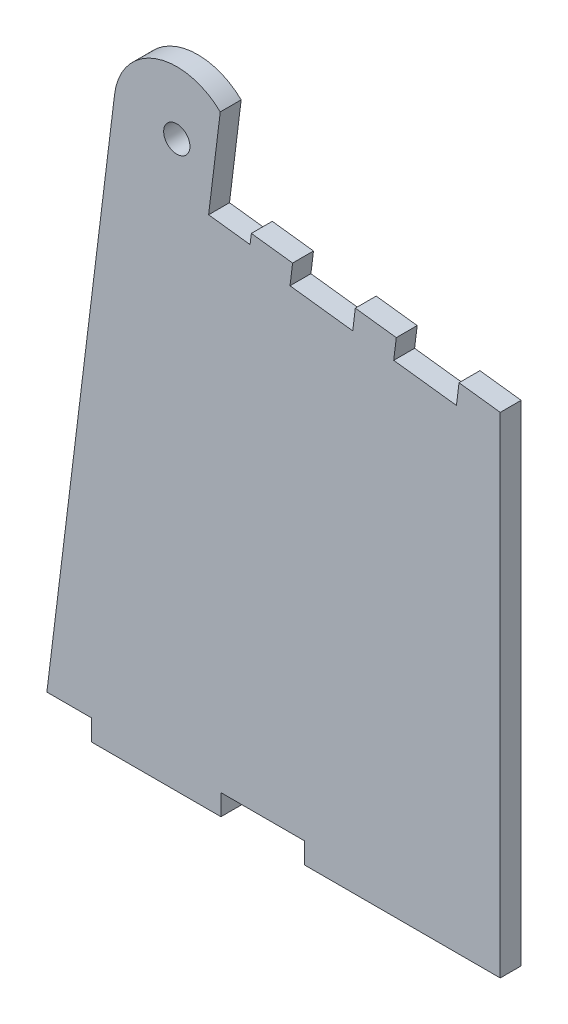
from build123d import *

# Parameters (mm, degrees)
SKETCH1_R           = 4
BOSS_EXTRUDE1_DEPTH = 6.35


with BuildPart() as part:
    # Sketch1 → Boss-Extrude1 (new body)
    with BuildSketch(Plane.XY):
        with BuildLine():
            Line((15.931937103, 156.542159914), (19.474069569, 185.390513812))
            ThreePointArc((19.474069569, 185.390513812), (-0.107426276, 189.607166129), (-12.636025926, 173.978688048))
            Line((-12.636025926, 173.978688048), (-33.218240783, 6.35))
            Line((-33.218240783, 6.35), (-19.685, 6.35))
            Line((-19.685, 6.35), (-19.685, 0))
            Line((-19.685, 0), (0, 0))
            Line((0, 0), (19.685, 0))
            Line((19.685, 0), (19.685, 6.35))
            Line((19.685, 6.35), (45.085, 6.35))
            Line((45.085, 6.35), (45.085, 0))
            Line((45.085, 0), (104.55622515, 0))
            Line((104.55622515, 0), (104.55622515, 148.859309317))
            Line((104.55622515, 148.859309317), (92.026521041, 150.397763534))
            Line((92.026521041, 150.397763534), (91.243364266, 144.019463455))
            Line((91.243364266, 144.019463455), (72.184096044, 146.359647334))
            Line((72.184096044, 146.359647334), (72.967252818, 152.737947414))
            Line((72.967252818, 152.737947414), (60.513180726, 154.267115187))
            Line((60.513180726, 154.267115187), (59.730023951, 147.888815108))
            Line((59.730023951, 147.888815108), (40.670755729, 150.228998987))
            Line((40.670755729, 150.228998987), (41.453912504, 156.607299067))
            Line((41.453912504, 156.607299067), (28.924208395, 158.145753284))
            Line((28.924208395, 158.145753284), (28.537273229, 154.994419253))
            Line((28.537273229, 154.994419253), (15.931937103, 156.542159914))
        make_face()
        with Locations((6.271978263, 171.657077056)):
            Circle(SKETCH1_R, mode=Mode.SUBTRACT)
    extrude(amount=BOSS_EXTRUDE1_DEPTH)


solid = part.part
